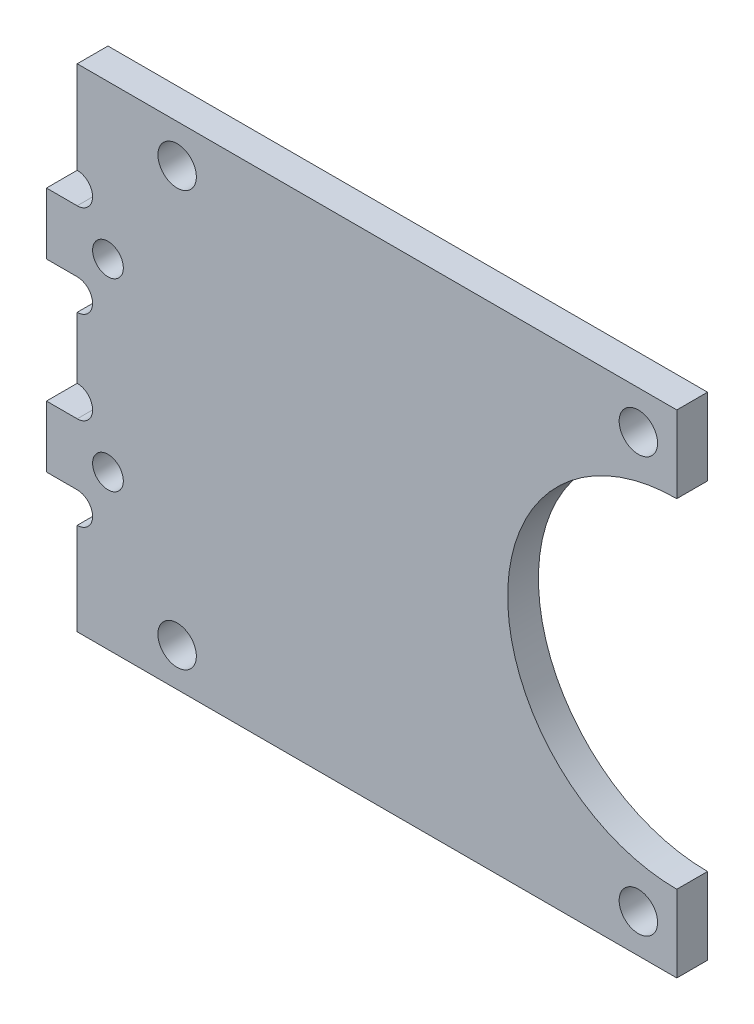
from build123d import *

# Parameters (mm, degrees)
SKETCH_1_R          = 1.25
SKETCH_1_R_2        = 1
EXTRUDE_1_DEPTH     = 2
CUT_EXTRUDE_1_DEPTH = 2


with BuildPart() as part:
    # 草圖1 → 填料-伸長1 (new body)
    with BuildSketch(Plane.XY):
        with BuildLine():
            Line((-17.216213198, 10.1625), (13.283786802, 10.1625))
            Line((13.283786802, 10.1625), (13.283786802, -21.8375))
            Line((13.283786802, -21.8375), (-17.216213198, -21.8375))
            Line((-17.216213198, -21.8375), (-19.716213198, -21.8375))
            Line((-19.716213198, -21.8375), (-25.716213198, -21.8375))
            Line((-25.716213198, -21.8375), (-25.716213198, -15.8375))
            ThreePointArc((-25.716213198, -15.8375), (-24.716213198, -14.8375), (-25.716213198, -13.8375))
            Line((-25.716213198, -13.8375), (-27.716213198, -13.8375))
            Line((-27.716213198, -13.8375), (-27.716213198, -9.8375))
            Line((-27.716213198, -9.8375), (-25.716213198, -9.8375))
            ThreePointArc((-25.716213198, -9.8375), (-24.716213198, -8.8375), (-25.716213198, -7.8375))
            Line((-25.716213198, -7.8375), (-25.716213198, -3.8375))
            ThreePointArc((-25.716213198, -3.8375), (-24.716213198, -2.8375), (-25.716213198, -1.8375))
            Line((-25.716213198, -1.8375), (-27.716213198, -1.8375))
            Line((-27.716213198, -1.8375), (-27.716213198, 2.1625))
            Line((-27.716213198, 2.1625), (-25.716213198, 2.1625))
            ThreePointArc((-25.716213198, 2.1625), (-24.716213198, 3.1625), (-25.716213198, 4.1625))
            Line((-25.716213198, 4.1625), (-25.716213198, 10.1625))
            Line((-25.716213198, 10.1625), (-21.716213198, 10.1625))
            Line((-21.716213198, 10.1625), (-17.216213198, 10.1625))
        make_face()
        with Locations((-19.216213198, 7.6625)):
            Circle(SKETCH_1_R, mode=Mode.SUBTRACT)
        with Locations((-19.216213198, -19.3375)):
            Circle(SKETCH_1_R, mode=Mode.SUBTRACT)
        with Locations((10.783786802, -19.3375)):
            Circle(SKETCH_1_R, mode=Mode.SUBTRACT)
        with Locations((10.783786802, 7.6625)):
            Circle(SKETCH_1_R, mode=Mode.SUBTRACT)
        with Locations((-23.716213198, 0.1625)):
            Circle(SKETCH_1_R_2, mode=Mode.SUBTRACT)
        with Locations((-23.716213198, -11.8375)):
            Circle(SKETCH_1_R_2, mode=Mode.SUBTRACT)
    extrude(amount=EXTRUDE_1_DEPTH)

    # 草圖4 → 除料-伸長1 (cut)
    with BuildSketch(Plane(origin=(0, 0, 0), x_dir=(-1, 0, 0), z_dir=(0, 0, -1))):
        with BuildLine():
            Line((-13.283786802, 5.1625), (-13.283786802, -16.8375))
            ThreePointArc((-13.283786802, -16.8375), (-2.283786802, -5.8375), (-13.283786802, 5.1625))
        make_face()
    extrude(amount=-CUT_EXTRUDE_1_DEPTH, mode=Mode.SUBTRACT)


solid = part.part
